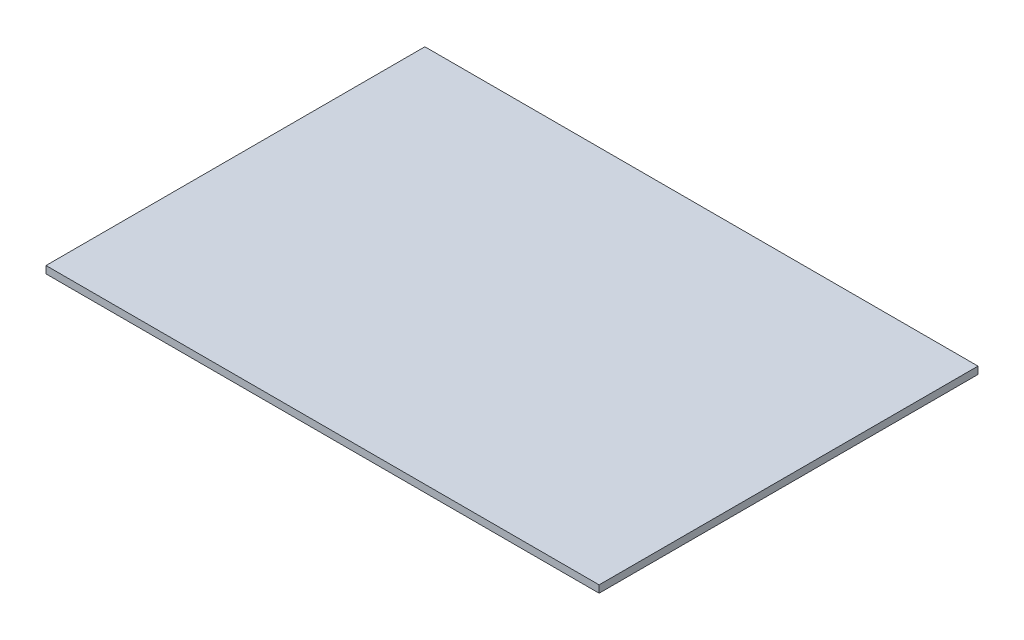
from build123d import *

# Parameters (mm, degrees)
SKETCH1_W           = 965.2
SKETCH1_H           = 661.17
BOSS_EXTRUDE1_DEPTH = 12.7


with BuildPart() as part:
    # Sketch1 → Boss-Extrude1 (new body)
    with BuildSketch(Plane(origin=(0, 0, 0), x_dir=(1, 0, 0), z_dir=(0, 1, 0))):
        Rectangle(SKETCH1_W, SKETCH1_H)
    extrude(amount=BOSS_EXTRUDE1_DEPTH)


solid = part.part
